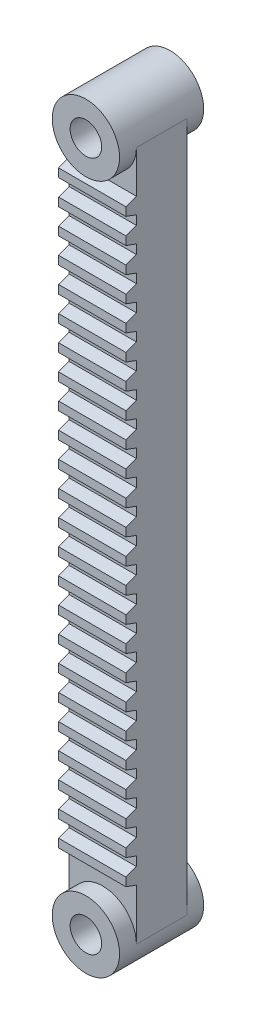
from build123d import *

# Parameters (mm, degrees)
BOSS_EXTRUDE1_DEPTH = 12
BOSS_EXTRUDE2_START = -4
SKETCH3_3_R         = 8
SKETCH3_3_R_2       = 3.75
BOSS_EXTRUDE2_DEPTH = 20
BOSS_EXTRUDE3_DEPTH = 8
LPATTERN1_COUNT     = 24
LPATTERN1_PITCH     = 6


with BuildPart() as part:
    # Sketch3 → Boss-Extrude1 (new body)
    with BuildSketch(Plane(origin=(0, 0, 0), x_dir=(0, 1, 0), z_dir=(0, 0, 1))):
        with BuildLine():
            ThreePointArc((-74, 0), (-76.343145751, -5.656854249), (-82, -8))
            Line((-82, -8), (82, -8))
            ThreePointArc((82, -8), (74, 0), (82, 8))
            Line((82, 8), (-82, 8))
            ThreePointArc((-82, 8), (-76.343145751, 5.656854249), (-74, 0))
        make_face()
    extrude(amount=BOSS_EXTRUDE1_DEPTH)

    # Sketch3<3> → Boss-Extrude2 (add)
    # profile 1 of 2: a face of its own
    with BuildSketch(Plane(origin=(0, 0, 0), x_dir=(0, 1, 0), z_dir=(0, 0, 1)).offset(BOSS_EXTRUDE2_START)):
        with Locations((-82, 0)):
            Circle(SKETCH3_3_R)
        with Locations((-82, 0)):
            Circle(SKETCH3_3_R_2, mode=Mode.SUBTRACT)
    # profile 2 of 2: a face of its own
    with BuildSketch(Plane(origin=(0, 0, 0), x_dir=(0, 1, 0), z_dir=(0, 0, 1)).offset(BOSS_EXTRUDE2_START)):
        with Locations((82, 0)):
            Circle(SKETCH3_3_R)
        with Locations((82, 0)):
            Circle(SKETCH3_3_R_2, mode=Mode.SUBTRACT)
    extrude(amount=BOSS_EXTRUDE2_DEPTH)

    # Sketch4 → Boss-Extrude3 (add, symmetric)
    with BuildSketch(Plane.YZ):
        Polygon((72, 12), (71.090074414, 14.5), (69.090074414, 14.5), (68.180148829, 12), align=None)
    boss_extrude3 = extrude(amount=BOSS_EXTRUDE3_DEPTH, both=True)

    # LPattern1: Boss-Extrude3 ×24
    with Locations(*[(0, -i * LPATTERN1_PITCH, 0) for i in range(1, LPATTERN1_COUNT)]):
        add(boss_extrude3)


solid = part.part
